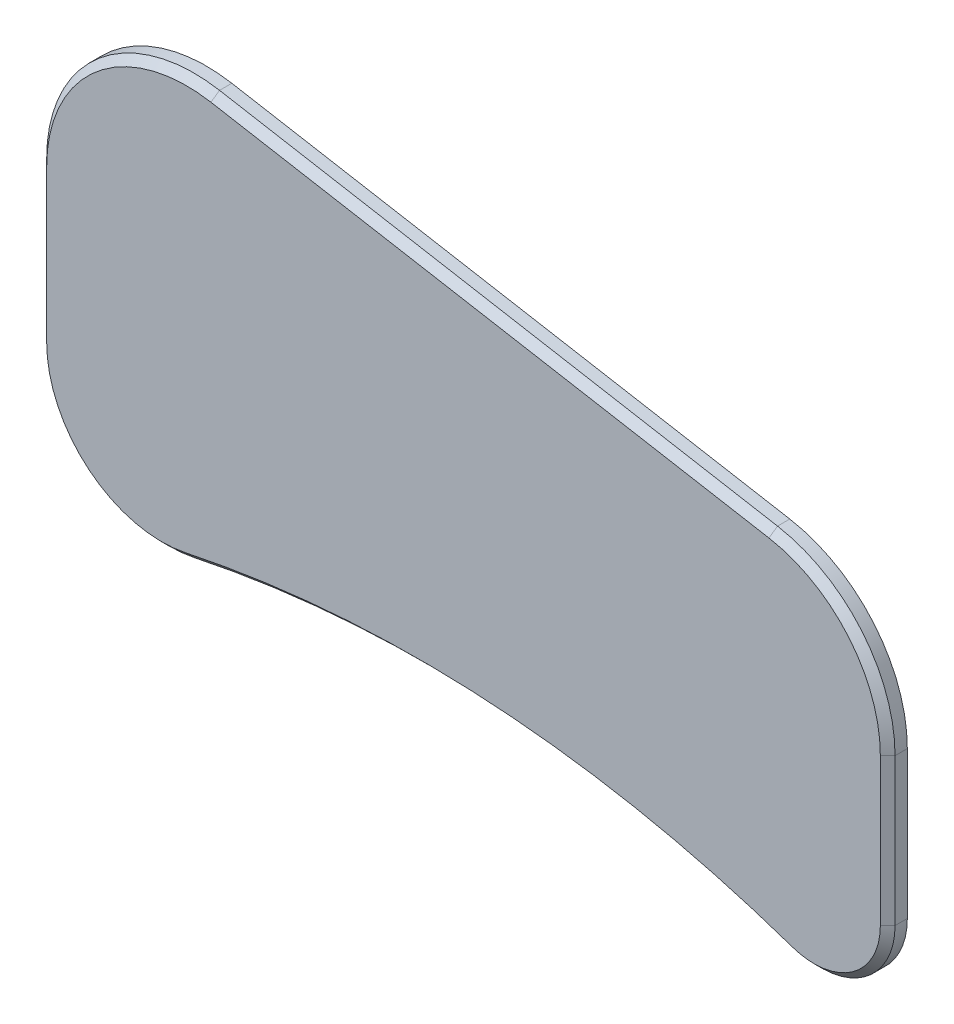
from build123d import *

# Parameters (mm, degrees)
BOSS_EXTRUDE1_DEPTH = 4
CHAMFER1_SIZE       = 1.5


with BuildPart() as part:
    # Sketch1 → Boss-Extrude1 (new body)
    with BuildSketch(Plane.XY):
        with BuildLine():
            Line((-54.748665604, 40.101038648), (59.035797152, 20.037767879))
            ThreePointArc((59.035797152, 20.037767879), (76.21528885, 10.119183723), (83, -8.521656958))
            Line((83, -8.521656958), (83, -38.521656958))
            ThreePointArc((83, -38.521656958), (76.697736677, -50.742515222), (63.086749774, -52.694164578))
            ThreePointArc((63.086749774, -52.694164578), (2.15504295, -40.457474253), (-59.828407224, -44.980901185))
            ThreePointArc((-59.828407224, -44.980901185), (-80.743414188, -39.941876053), (-90, -20.521656958))
            Line((-90, -20.521656958), (-90, 10.521656958))
            ThreePointArc((-90, 10.521656958), (-79.270878905, 33.530331398), (-54.748665604, 40.101038648))
        make_face()
    extrude(amount=BOSS_EXTRUDE1_DEPTH)

    # Chamfer1
    chamfer1_edges = [part.edges().sort_by_distance(p)[0] for p in [
        (-80.743414188, -39.941876053, 4),
        (2.15504295, -40.457474253, 4),
        (76.697736677, -50.742515222, 4),
        (83, -23.521656958, 4),
        (76.21528885, 10.119183723, 4),
        (2.143565774, 30.069403264, 4),
        (-79.270878905, 33.530331398, 4),
        (-90, -5, 4),
    ]]
    chamfer(chamfer1_edges, length=CHAMFER1_SIZE)


solid = part.part
